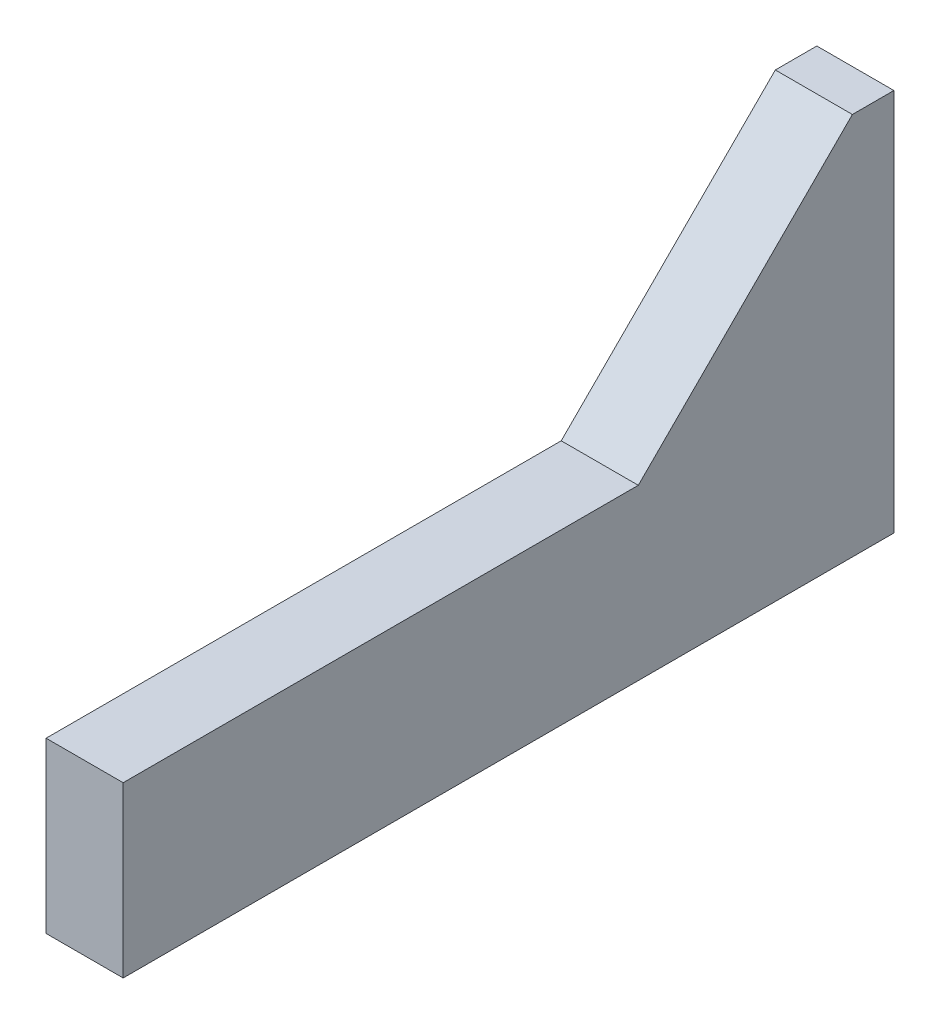
from build123d import *

# Parameters (mm, degrees)
SKETCH_1_W          = 9
SKETCH_1_H          = 15
EXTRUDE_1_DEPTH     = 90
SKETCH_2_R          = 2.1
CUT_EXTRUDE_1_DEPTH = 6
SKETCH_3_W          = 5
SKETCH_3_H          = 2.25
EXTRUDE_2_DEPTH     = 3
CHAMFER_1_SIZE      = 0.75
EXTRUDE_3_DEPTH     = 9
SKETCH_4_R          = 2.1
CUT_EXTRUDE_2_DEPTH = 6


with BuildPart() as part:
    # Эскиз1 → Бобышка-Вытянуть1 (new body)
    with BuildSketch(Plane.XY):
        Rectangle(SKETCH_1_W, SKETCH_1_H)
        Polygon((-4.5, 12.25), (-4.5, 7.5), (-0.5, 7.5), (-0.5, 9.75), (4.5, 9.75), (4.5, 12.25), align=None)
    extrude(amount=EXTRUDE_1_DEPTH)

    # Эскиз2 → Вырез-Вытянуть1 (cut)
    with BuildSketch(Plane.XZ.offset(7.5)):
        with Locations(Location((0, 22.5, 0), (0, 0, 270))):
            Circle(SKETCH_2_R)
        with Locations(Location((0, 67.5, 0), (0, 0, 270))):
            Circle(SKETCH_2_R)
        with Locations(Location((0, 45, 0), (0, 0, 270))):
            Circle(SKETCH_2_R)
    extrude(amount=-CUT_EXTRUDE_1_DEPTH, mode=Mode.SUBTRACT)

    # Эскиз3 → Бобышка-Вытянуть2 (add)
    with BuildSketch(Plane(origin=(0, 0, 90), x_dir=(-1, 0, 0), z_dir=(0, 0, -1))):
        with Locations((-2, 8.625)):
            Rectangle(SKETCH_3_W, SKETCH_3_H)
    extrude(amount=EXTRUDE_2_DEPTH)

    # Фаска1
    chamfer_1_edges = [part.edges().sort_by_distance(p)[0] for p in [
        (4.5, 9.75, 43.5),
        (4.5, 7.5, 43.5),
    ]]
    chamfer(chamfer_1_edges, length=CHAMFER_1_SIZE)

    # Эскиз5 → Бобышка-Вытянуть3 (add)
    with BuildSketch(Plane.ZY.offset(4.5)):
        Polygon((0, 12.25), (0, 37.25), (4.84785343, 37.25), (29.84785343, 12.25), align=None)
    extrude(amount=-EXTRUDE_3_DEPTH)

    # Эскиз4 → Вырез-Вытянуть2 (cut)
    with BuildSketch(Plane(origin=(0, 0, 0), x_dir=(-1, 0, 0), z_dir=(0, 0, -1))):
        with Locations((0, 2.5)):
            Circle(SKETCH_4_R)
        with Locations((0, 27.25)):
            Circle(SKETCH_4_R)
    extrude(amount=-CUT_EXTRUDE_2_DEPTH, mode=Mode.SUBTRACT)


with BuildPart() as body_2:
    # Зеркальное отражение1: mirrored copy
    add(part.part.mirror(Plane(origin=(-4.5, 0, 90), x_dir=(0, 0, 1), z_dir=(-1, 0, 0))))


solid = body_2.part
